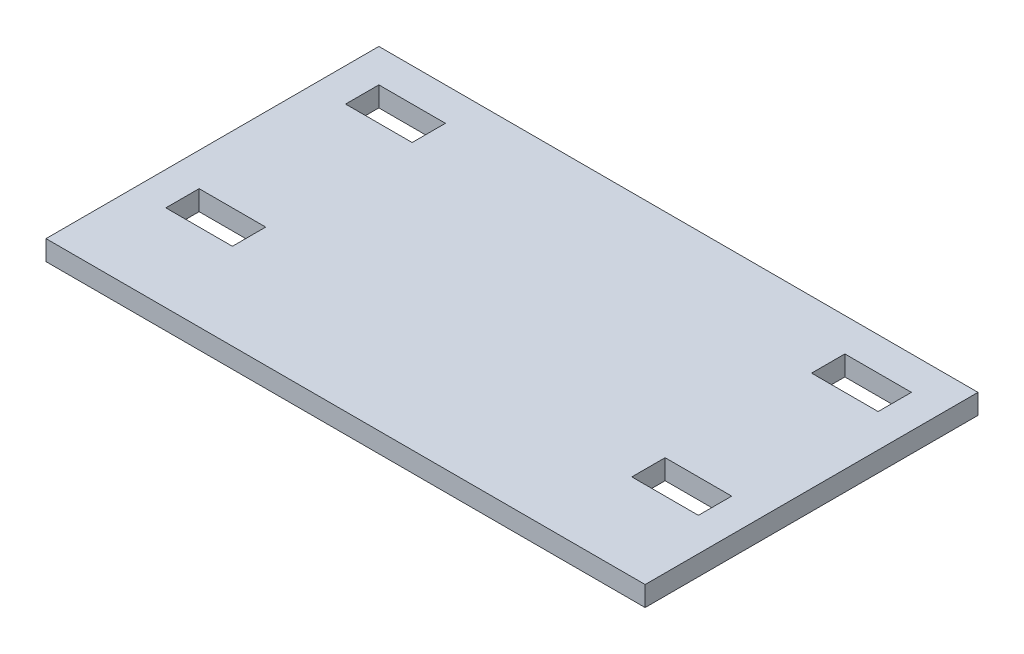
from build123d import *

# Parameters (mm, degrees)
SKETCH1_W           = 90
SKETCH1_H           = 50
BOSS_EXTRUDE1_DEPTH = 3
SKETCH2_W           = 10
SKETCH2_H           = 5
CUT_EXTRUDE1_DEPTH  = 3


with BuildPart() as part:
    # Sketch1 → Boss-Extrude1 (new body)
    with BuildSketch(Plane(origin=(0, 0, 0), x_dir=(1, 0, 0), z_dir=(0, 1, 0))):
        Rectangle(SKETCH1_W, SKETCH1_H)
    extrude(amount=BOSS_EXTRUDE1_DEPTH)

    # Sketch2 → Cut-Extrude1 (cut)
    with BuildSketch(Plane(origin=(0, 3, 0), x_dir=(1, 0, 0), z_dir=(0, 1, 0))):
        with Locations((-35, 17.5)):
            Rectangle(SKETCH2_W, SKETCH2_H)
        with Locations((35, 17.5)):
            Rectangle(SKETCH2_W, SKETCH2_H)
        with Locations((35, -9.5)):
            Rectangle(SKETCH2_W, SKETCH2_H)
        with Locations((-35, -9.5)):
            Rectangle(SKETCH2_W, SKETCH2_H)
    extrude(amount=-CUT_EXTRUDE1_DEPTH, mode=Mode.SUBTRACT)


solid = part.part
